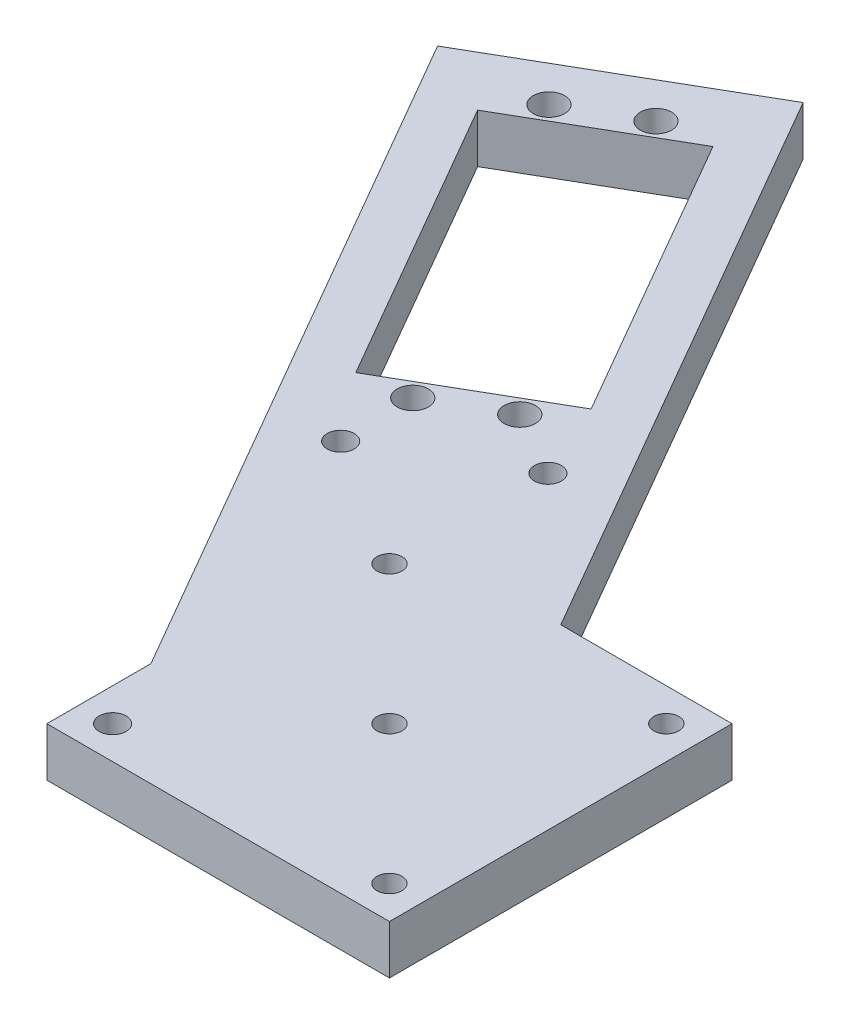
from build123d import *

# Parameters (mm, degrees)
SKETCH1_R           = 1.75
SKETCH1_R_2         = 1.625
SKETCH1_R_3         = 1.74995
BOSS_EXTRUDE1_DEPTH = 6.35
SKETCH2_R           = 1.74995
CUT_EXTRUDE1_DEPTH  = 122.309718695


with BuildPart() as part:
    # Sketch1 → Boss-Extrude1 (new body)
    with BuildSketch(Plane(origin=(0, 0, 0), x_dir=(1, 0, 0), z_dir=(0, 1, 0))):
        Polygon((22.35631132, -22.09368868), (22.35631132, 22.35631132), (0.13131132, 22.35631132), (-42.824896411, 96.75864561), (-72.89368868, 79.3984203), (-22.09368868, -8.589760725), (-22.09368868, -22.09368868), align=None)
        with Locations(Location((-17.829200922, -17.829200922, 0), (0, 0, 270))):
            Circle(SKETCH1_R, mode=Mode.SUBTRACT)
        with Locations(Location((0.13131132, 0.13131132, 0), (0, 0, 270))):
            Circle(SKETCH1_R_2, mode=Mode.SUBTRACT)
        with Locations(Location((18.091823562, 18.091823562, 0), (0, 0, 270))):
            Circle(SKETCH1_R_2, mode=Mode.SUBTRACT)
        with Locations(Location((18.091823562, -17.829200922, 0), (0, 0, 270))):
            Circle(SKETCH1_R_2, mode=Mode.SUBTRACT)
        with Locations(Location((-17.829200922, 18.091823562, 0), (0, 0, 270))):
            Circle(SKETCH1_R_2, mode=Mode.SUBTRACT)
        with Locations(Location((-17.723762663, 38.544433004, 0), (0, 0, 270))):
            Circle(SKETCH1_R_3, mode=Mode.SUBTRACT)
        with Locations(Location((-34.76828868, 28.70377132, 0), (0, 0, 270))):
            Circle(SKETCH1_R_3, mode=Mode.SUBTRACT)
    extrude(amount=BOSS_EXTRUDE1_DEPTH)

    # Sketch2 → Cut-Extrude1 (cut, through all)
    with BuildSketch(Plane.XZ):
        with BuildLine():
            ThreePointArc((-49.268883494, -83.359508021), (-50.810803794, -83.156510362), (-52.044647115, -84.103271641))
            Line((-52.044647115, -84.103271641), (-50.284883494, -85.119271641))
            Line((-50.284883494, -85.119271641), (-49.268883494, -83.359508021))
        make_face()
        with BuildLine():
            Line((-50.284883494, -85.119271641), (-52.044647115, -84.103271641))
            ThreePointArc((-52.044647115, -84.103271641), (-50.810803794, -87.08203292), (-48.252883494, -85.119271641))
            ThreePointArc((-48.252883494, -85.119271641), (-48.525119874, -84.103271641), (-49.268883494, -83.359508021))
            Line((-49.268883494, -83.359508021), (-50.284883494, -85.119271641))
        make_face()
        with BuildLine():
            Line((-57.323937976, -81.055271641), (-59.083701597, -80.039271641))
            Line((-59.083701597, -80.039271641), (-58.067701597, -78.279508021))
            ThreePointArc((-58.067701597, -78.279508021), (-61.046462876, -80.565191941), (-57.323937976, -81.055271641))
        make_face()
        with BuildLine():
            Line((-58.067701597, -78.279508021), (-59.083701597, -80.039271641))
            Line((-59.083701597, -80.039271641), (-57.323937976, -81.055271641))
            ThreePointArc((-57.323937976, -81.055271641), (-57.120940318, -80.565191941), (-57.051701597, -80.039271641))
            ThreePointArc((-57.051701597, -80.039271641), (-57.323937976, -79.023271641), (-58.067701597, -78.279508021))
        make_face()
        with BuildLine():
            ThreePointArc((-27.914647115, -42.308885654), (-28.117644773, -43.850805954), (-27.170883494, -45.084649275))
            Line((-27.170883494, -45.084649275), (-26.154883494, -43.324885654))
            Line((-26.154883494, -43.324885654), (-27.914647115, -42.308885654))
        make_face()
        with BuildLine():
            Line((-26.154883494, -43.324885654), (-27.170883494, -45.084649275))
            ThreePointArc((-27.170883494, -45.084649275), (-25.138883494, -45.084649275), (-24.122883494, -43.324885654))
            ThreePointArc((-24.122883494, -43.324885654), (-25.628963195, -41.362124375), (-27.914647115, -42.308885654))
            Line((-27.914647115, -42.308885654), (-26.154883494, -43.324885654))
        make_face()
        with BuildLine():
            ThreePointArc((-32.921701597, -38.244885654), (-35.969701597, -36.485122034), (-35.969701597, -40.004649275))
            Line((-35.969701597, -40.004649275), (-34.953701597, -38.244885654))
            Line((-34.953701597, -38.244885654), (-33.193937976, -39.260885654))
            ThreePointArc((-33.193937976, -39.260885654), (-32.990940318, -38.770805954), (-32.921701597, -38.244885654))
        make_face()
        with BuildLine():
            Line((-34.953701597, -38.244885654), (-35.969701597, -40.004649275))
            ThreePointArc((-35.969701597, -40.004649275), (-34.427781297, -40.207646933), (-33.193937976, -39.260885654))
            Line((-33.193937976, -39.260885654), (-34.953701597, -38.244885654))
        make_face()
        with Locations(Location((-17.723762663, -38.544433004, 0), (0, 0, 90))):
            Circle(SKETCH2_R)
        Polygon((-22.145592633, -48.57259018), (-43.735592633, -85.967567115), (-63.092992458, -74.791567115), (-41.502992458, -37.39659018), align=None)
    extrude(amount=-CUT_EXTRUDE1_DEPTH, mode=Mode.SUBTRACT)


solid = part.part
